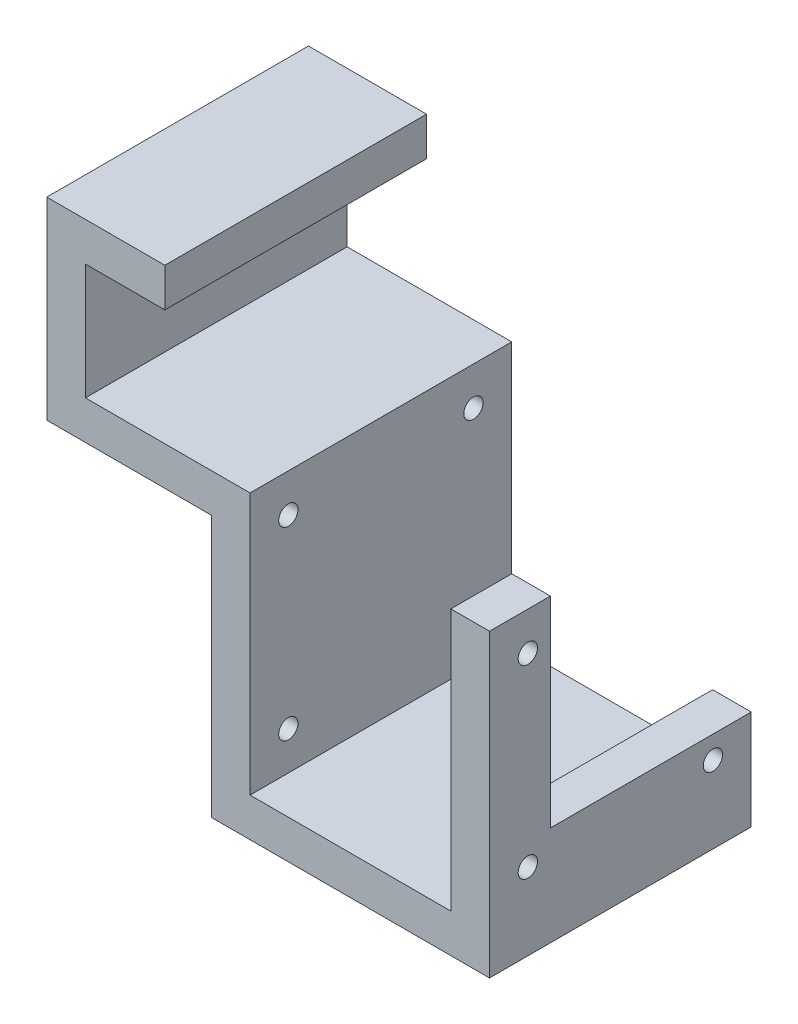
from build123d import *

# Parameters (mm, degrees)
BOSS_EXTRUDE1_DEPTH     = 43
SKETCH2_W               = 33
SKETCH2_H               = 6.35
SKETCH2_H_2             = 10
SKETCH2_R               = 1.5
SKETCH2_W_2             = 10
BOSS_EXTRUDE2_DEPTH     = 6.35
CUT_EXTRUDE1_DEPTH      = 79.339645136
CUT_EXTRUDE1_DEPTH_BACK = 12.7
SKETCH3_R               = 1.5875


with BuildPart() as part:
    # Sketch1 → Boss-Extrude1 (new body)
    with BuildSketch(Plane.XY):
        Polygon((-6.35, -27.85), (-6.35, 15.15), (-33.4, 15.15), (-33.4, 46.9), (-14, 46.9), (-14, 40.55), (-27.05, 40.55), (-27.05, 21.5), (0, 21.5), (0, -21.5), (33, -21.5), (33, -27.85), align=None)
    extrude(amount=-BOSS_EXTRUDE1_DEPTH)

    # Sketch2 → Boss-Extrude2 (add)
    # profile 1 of 4: a face of its own
    with BuildSketch(Plane(origin=(33, 0, 0), x_dir=(0, 0, -1), z_dir=(1, 0, 0))):
        with Locations((16.5, -24.675)):
            Rectangle(SKETCH2_W, SKETCH2_H)
    # profile 2 of 4: a face of its own
    with BuildSketch(Plane(origin=(33, 0, 0), x_dir=(0, 0, -1), z_dir=(1, 0, 0))):
        with Locations((16.5, -16.5)):
            Rectangle(SKETCH2_W, SKETCH2_H_2)
        with Locations((6.294174233, -15.205825767)):
            Circle(SKETCH2_R, mode=Mode.SUBTRACT)
    # profile 3 of 4: a face of its own
    with BuildSketch(Plane(origin=(33, 0, 0), x_dir=(0, 0, -1), z_dir=(1, 0, 0))):
        with Locations((38, -24.675)):
            Rectangle(SKETCH2_W_2, SKETCH2_H)
    # profile 4 of 4: a face of its own
    with BuildSketch(Plane(origin=(33, 0, 0), x_dir=(0, 0, -1), z_dir=(1, 0, 0))):
        Polygon((33, -11.5), (33, -21.5), (43, -21.5), (43, 21.5), (33, 21.5), align=None)
        with Locations((36.705825767, -15.205825767)):
            Circle(SKETCH2_R, mode=Mode.SUBTRACT)
        with Locations((36.705825767, 15.205825767)):
            Circle(SKETCH2_R, mode=Mode.SUBTRACT)
    extrude(amount=BOSS_EXTRUDE2_DEPTH)

    # Sketch3 → Cut-Extrude1 (cut, two sides: drawn at the far end of the back side and taken through both)
    with BuildSketch(Plane(origin=(-6.35, 0, 0), x_dir=(0, 0, -1), z_dir=(1, 0, 0)).offset(-CUT_EXTRUDE1_DEPTH_BACK)):
        with Locations(Location((6.294174233, -15.205825767, 0), (0, 0, 270))):
            Circle(SKETCH3_R)
        with Locations(Location((6.294174233, 15.205825767, 0), (0, 0, 270))):
            Circle(SKETCH3_R)
        with Locations(Location((36.705825767, 15.205825767, 0), (0, 0, 270))):
            Circle(SKETCH3_R)
        with Locations(Location((36.705825767, -15.205825767, 0), (0, 0, 270))):
            Circle(SKETCH3_R)
    extrude(amount=CUT_EXTRUDE1_DEPTH + CUT_EXTRUDE1_DEPTH_BACK, mode=Mode.SUBTRACT)


with BuildPart() as body_2:
    # Mirror1: mirrored copy
    add(part.part.mirror(Plane.XY))


solid = body_2.part
